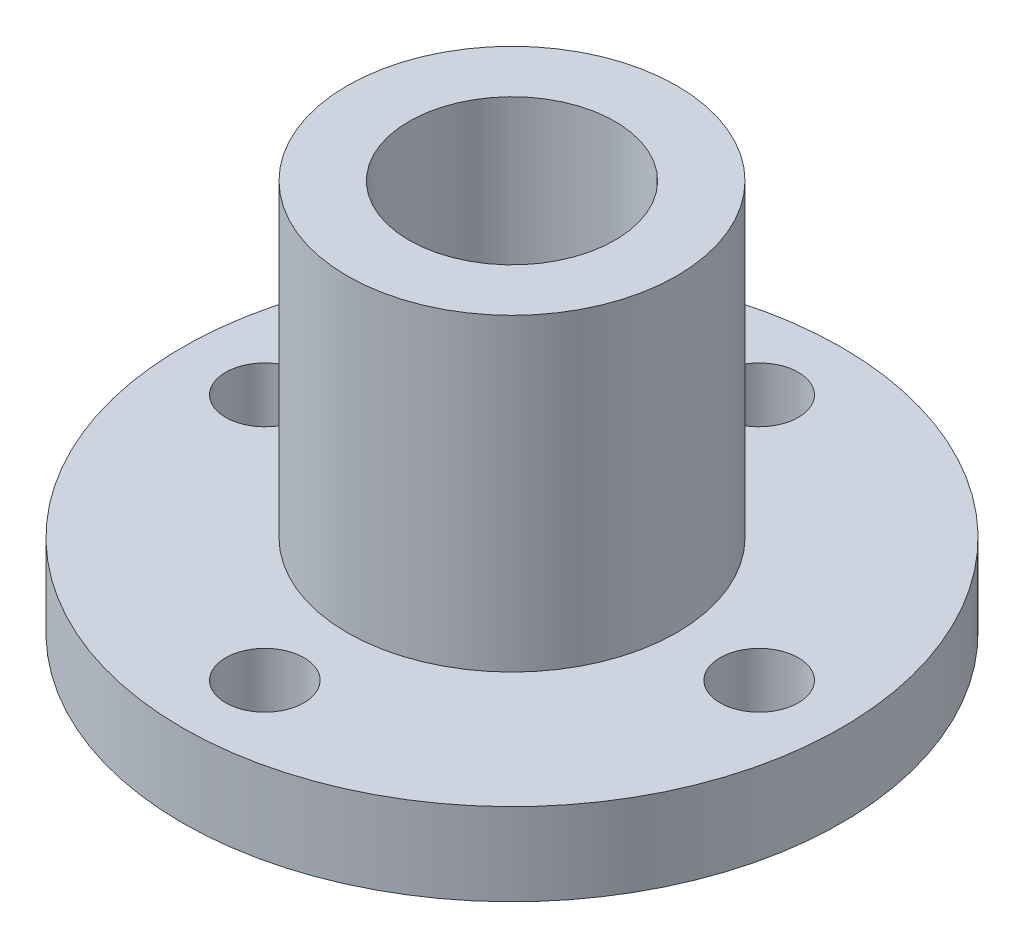
from build123d import *

# Parameters (mm, degrees)
SKETCH1_R           = 16
BOSS_EXTRUDE1_DEPTH = 4
SKETCH2_R           = 8
BOSS_EXTRUDE2_DEPTH = 19
CUT_EXTRUDE4_REACH  = 31.547
SKETCH3_R           = 1.9
CIRPATTERN1_COUNT   = 4
CUT_EXTRUDE6_REACH  = 31.547
SKETCH4_R           = 5


with BuildPart() as part:
    # Sketch1 → Boss-Extrude1 (new body)
    with BuildSketch(Plane(origin=(0, 0, 0), x_dir=(1, 0, 0), z_dir=(0, 1, 0))):
        with Locations(Location((0, 0, 0), (0, 0, 270))):
            Circle(SKETCH1_R)
    extrude(amount=BOSS_EXTRUDE1_DEPTH)

    # Sketch2 → Boss-Extrude2 (add)
    with BuildSketch(Plane(origin=(0, 0, 0), x_dir=(1, 0, 0), z_dir=(0, 1, 0))):
        with Locations(Location((0, 0, 0), (0, 0, 270))):
            Circle(SKETCH2_R)
    extrude(amount=BOSS_EXTRUDE2_DEPTH)

    # Sketch3 → Cut-Extrude4 (cut, up to next)
    with BuildSketch(Plane(origin=(0, 0, 0), x_dir=(1, 0, 0), z_dir=(0, 1, 0)), mode=Mode.PRIVATE) as cut_extrude4_sk1:
        with Locations(Location((-12, 0, 0), (0, 0, 270))):
            Circle(SKETCH3_R)
    cut_extrude4_tool1 = extrude(cut_extrude4_sk1.sketch, amount=CUT_EXTRUDE4_REACH, mode=Mode.PRIVATE) & part.part
    cut_extrude4 = cut_extrude4_tool1.solids().sort_by_distance((-12, 0, 0))[0]
    add(cut_extrude4, mode=Mode.SUBTRACT)

    # CirPattern1: Cut-Extrude4 ×4 about axis
    cirpattern1_axis = Axis((0, 0, 0), (0, 1, 0))
    for i in range(1, CIRPATTERN1_COUNT):
        add(cut_extrude4.rotate(cirpattern1_axis, i * 360 / CIRPATTERN1_COUNT), mode=Mode.SUBTRACT)

    # Sketch4 → Cut-Extrude6 (cut, up to next)
    with BuildSketch(Plane(origin=(0, 0, 0), x_dir=(1, 0, 0), z_dir=(0, 1, 0)), mode=Mode.PRIVATE) as cut_extrude6_sk1:
        with Locations(Location((0, 0, 0), (0, 0, 270))):
            Circle(SKETCH4_R)
    cut_extrude6_tool1 = extrude(cut_extrude6_sk1.sketch, amount=CUT_EXTRUDE6_REACH, mode=Mode.PRIVATE) & part.part
    add(cut_extrude6_tool1.solids().sort_by_distance((0, 0, 0))[0], mode=Mode.SUBTRACT)


solid = part.part
